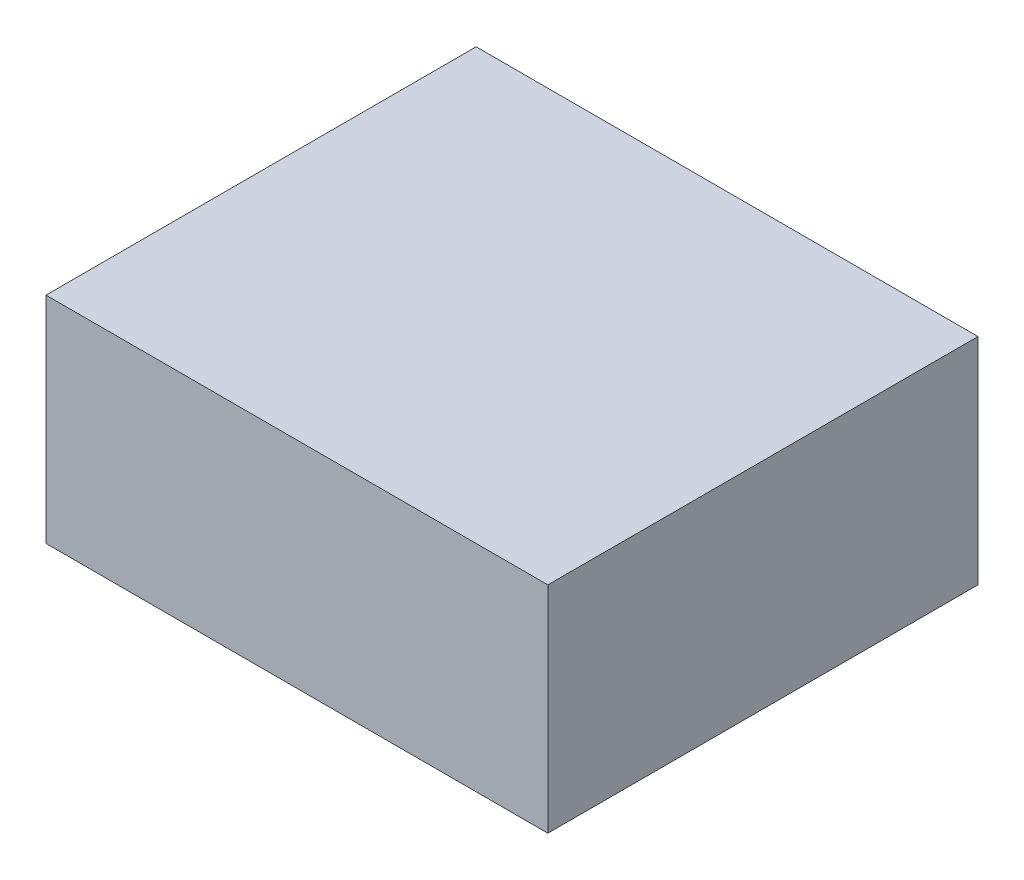
from build123d import *

# Parameters (mm, degrees)
SKETCH_1_W      = 70
SKETCH_1_H      = 60
EXTRUDE_1_DEPTH = 30


with BuildPart() as part:
    # 草图1 → 凸台-拉伸1 (new body)
    with BuildSketch(Plane(origin=(0, 0, 0), x_dir=(1, 0, 0), z_dir=(0, 1, 0))):
        Rectangle(SKETCH_1_W, SKETCH_1_H)
    extrude(amount=EXTRUDE_1_DEPTH)


solid = part.part
